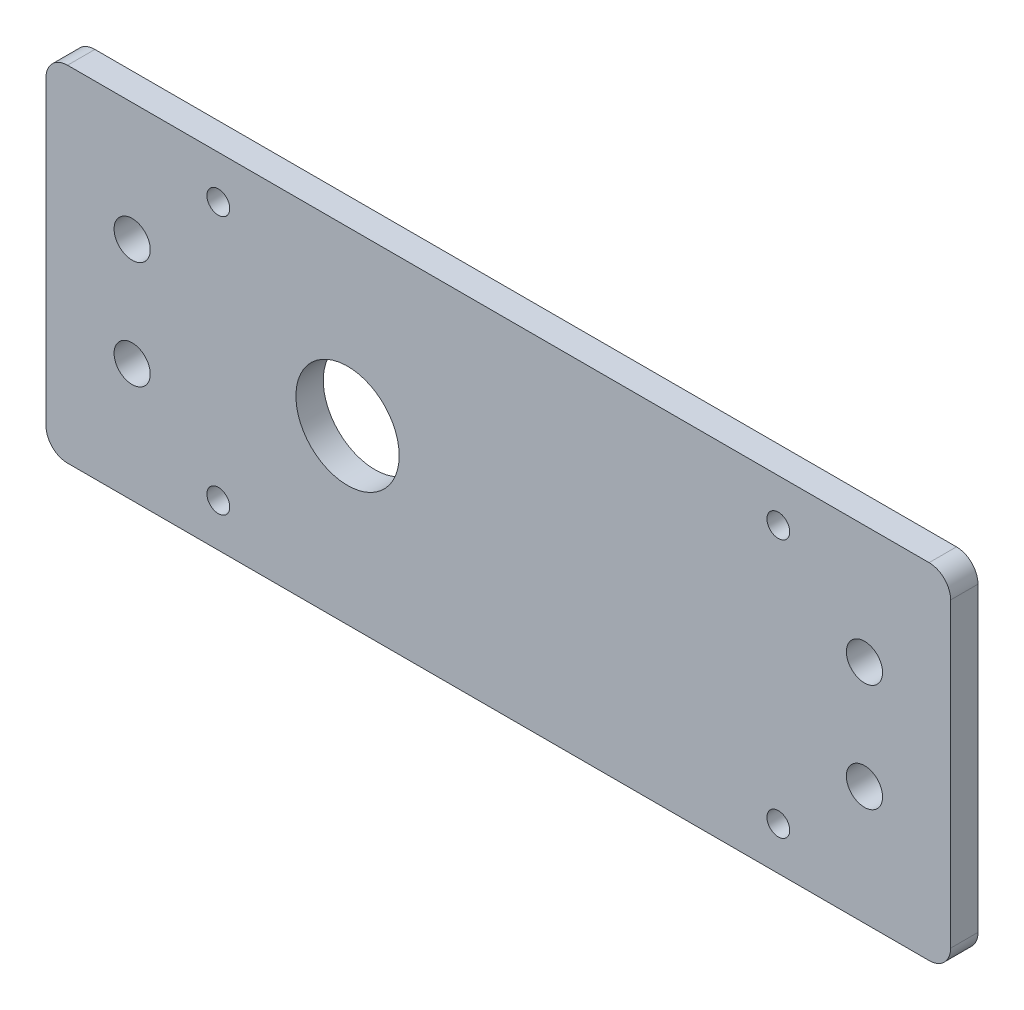
from build123d import *

# Parameters (mm, degrees)
SKETCH1_W            = 210
SKETCH1_H            = 80
SKETCH1_R            = 11.9875
BOSS_EXTRUDE1_DEPTH  = 6.35
M5_CLEARANCE_HOLE1_D = 5.3
FILLET1_R            = 5
M8_CLEARANCE_HOLE2_D = 8.4


with BuildPart() as part:
    # Sketch1 → Boss-Extrude1 (new body)
    with BuildSketch(Plane.XY):
        with Locations((35, 0)):
            Rectangle(SKETCH1_W, SKETCH1_H)
        Circle(SKETCH1_R, mode=Mode.SUBTRACT)
    extrude(amount=-BOSS_EXTRUDE1_DEPTH)

    # M5 Clearance Hole1 (through all)
    with Locations(Plane(origin=(-30, 30, 0), x_dir=(1, 0, 0), z_dir=(0, 0, 1))):
        with Locations((0, 0), (0, -60), (130, -60), (130, 0)):
            Hole(M5_CLEARANCE_HOLE1_D / 2)

    # Fillet1
    fillet1_edges = [part.edges().sort_by_distance(p)[0] for p in [
        (-70, 40, -3.175),
        (140, 40, -3.175),
        (140, -40, -3.175),
        (-70, -40, -3.175),
    ]]
    fillet(fillet1_edges, radius=FILLET1_R)

    # M8 Clearance Hole2 (through all)
    with Locations(Plane(origin=(-50, 12.5, 0), x_dir=(1, 0, 0), z_dir=(0, 0, 1))):
        with Locations((0, 0), (0, -25), (170, -25), (170, 0)):
            Hole(M8_CLEARANCE_HOLE2_D / 2)


solid = part.part
